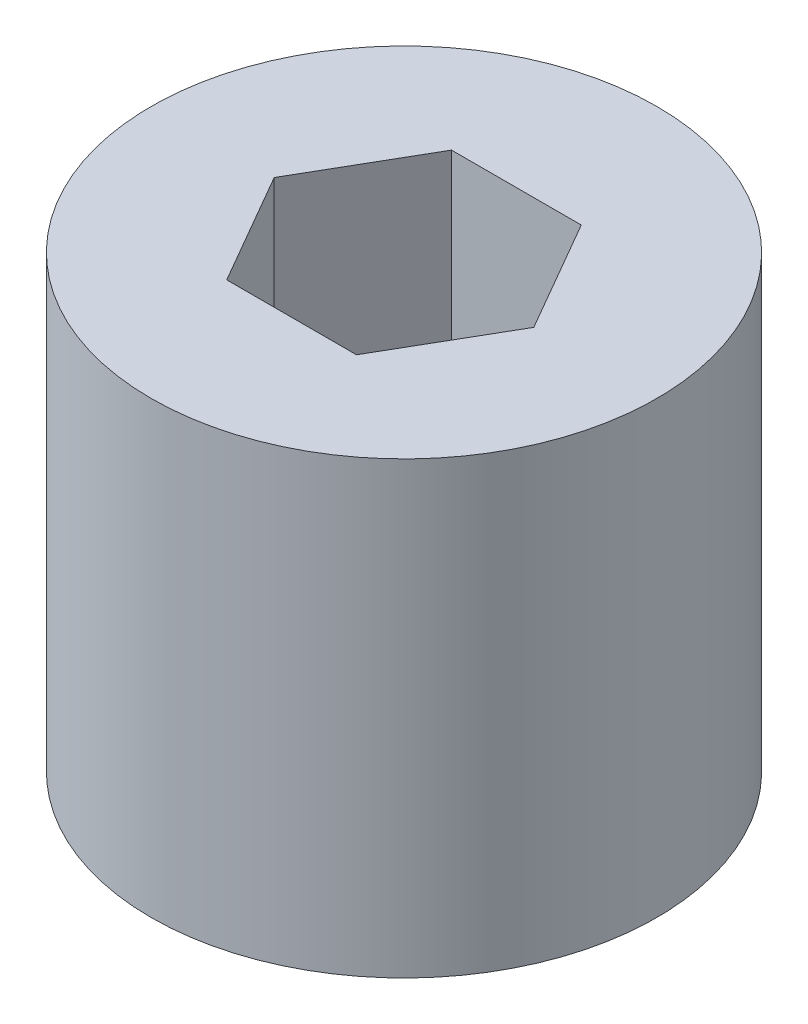
from build123d import *

# Parameters (mm, degrees)
SKETCH1_R           = 14.2875
BOSS_EXTRUDE1_DEPTH = 25.4


with BuildPart() as part:
    # Sketch1 → Boss-Extrude1 (new body)
    with BuildSketch(Plane(origin=(0, 0, 0), x_dir=(1, 0, 0), z_dir=(0, 1, 0))):
        with Locations(Location((0, 0, 0), (0, 0, 270))):
            Circle(SKETCH1_R)
        Polygon((7.332348419, 0), (3.666174209, 6.35), (-3.666174209, 6.35), (-7.332348419, 0), (-3.666174209, -6.35), (3.666174209, -6.35), align=None, mode=Mode.SUBTRACT)
    extrude(amount=BOSS_EXTRUDE1_DEPTH)


solid = part.part
